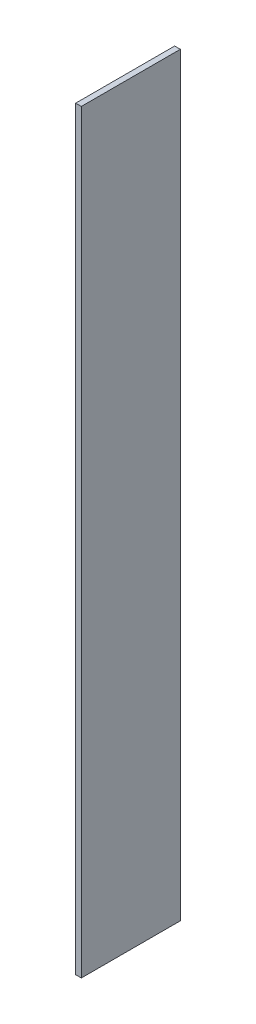
from build123d import *

# Parameters (mm, degrees)
SKETCH_1_W      = 4
SKETCH_1_H      = 69.902278357
EXTRUDE_1_DEPTH = 533


with BuildPart() as part:
    # Эскиз1 → Вытянуть1 (new body)
    with BuildSketch(Plane(origin=(0, 0, 0), x_dir=(1, 0, 0), z_dir=(0, 1, 0))):
        with Locations((3, -24.802944978)):
            Rectangle(SKETCH_1_W, SKETCH_1_H)
    extrude(amount=EXTRUDE_1_DEPTH)


solid = part.part
